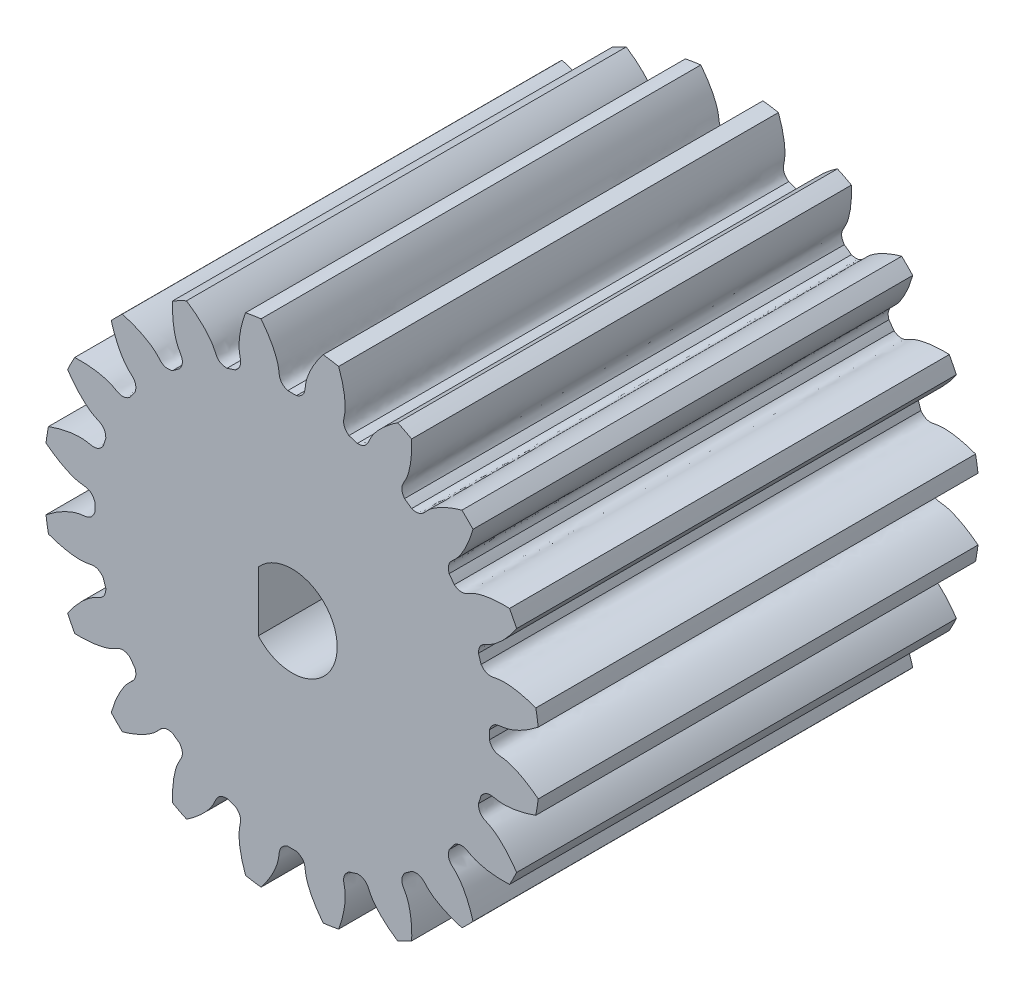
from build123d import *

# Parameters (mm, degrees)
SKETCH_1_R               = 11
EXTRUDE_1_DEPTH          = 19.5
CUT_EXTRUDE_1_DEPTH      = 25.944939367
PATTERN_CIRCULAR_1_COUNT = 20
CUT_EXTRUDE_2_DEPTH      = 10


with BuildPart() as part:
    # 草图1 → 凸台-拉伸1 (new body)
    with BuildSketch(Plane.XY):
        Circle(SKETCH_1_R)
    extrude(amount=EXTRUDE_1_DEPTH)

    # 草图2 → 切除-拉伸1 (cut, through all)
    with BuildSketch(Plane.XY):
        with BuildLine():
            ThreePointArc((0.1933166, 8.747864236), (0, 8.75), (-0.1933166, 8.747864236))
            add(Edge.make_bspline(
                [(-0.1933166, 8.747864236), (-0.611189405, 8.893475512), (-0.557084099, 9.187113699), (-0.612897056, 9.470009403), (-0.618892186, 9.497556614), (-0.62631089, 9.528634615), (-0.635292097, 9.563196836), (-0.64597914, 9.601191497), (-0.658512055, 9.642562828), (-0.673029871, 9.687250733), (-0.68966975, 9.735190947), (-0.7085671, 9.786315045), (-0.729855399, 9.840550501), (-0.753666102, 9.897820731), (-0.780128531, 9.958045151), (-0.809369765, 10.021139231), (-0.841514533, 10.087014551), (-0.876685117, 10.155578861), (-0.915001238, 10.22673615), (-0.956579966, 10.300386704), (-1.001535609, 10.376427181), (-1.049979626, 10.454750678), (-1.102020521, 10.535246805), (-1.157763756, 10.617801764), (-1.217311651, 10.70229842), (-1.280763301, 10.78861639), (-1.34821448, 10.876632121), (-1.419757562, 10.966218973), (-1.495481426, 11.057247311), (-1.575471385, 11.149584594), (-1.659809097, 11.243095463), (-1.748572489, 11.337641835), (-1.841835684, 11.433083002), (-1.939668926, 11.529275727), (-2.042138506, 11.626074339), (-2.149306698, 11.723330842), (-2.261231689, 11.820895011), (-2.377967518, 11.918614499), (-2.499564012, 12.016334946), (-2.626066734, 12.113900082), (-2.757516899, 12.21115184), (-2.941473591, 12.341639868), (-3.083932413, 12.436332601), (-3.181157982, 12.49825186)],
                knots=[0, 0, 0, 0, 0.165916003, 0.170905922, 0.176663519, 0.183188797, 0.190481754, 0.198542391, 0.207370708, 0.216966704, 0.22733038, 0.238461736, 0.250360771, 0.263027487, 0.276461881, 0.290663956, 0.30563371, 0.321371144, 0.337876258, 0.355149051, 0.373189524, 0.391997677, 0.411573509, 0.431917021, 0.453028213, 0.474907084, 0.497553636, 0.520967867, 0.545149777, 0.570099367, 0.595816637, 0.622301587, 0.649554216, 0.677574526, 0.706362514, 0.735918183, 0.766241531, 0.797332559, 0.829191267, 0.861817654, 0.895211721, 0.929373468, 1, 1, 1, 1], degree=3))
            ThreePointArc((-3.181157982, 12.49825186), (0, 12.89674632), (3.181157982, 12.49825186))
            add(Edge.make_bspline(
                [(0.1933166, 8.747864236), (0.611189405, 8.893475512), (0.557084099, 9.187113699), (0.612897056, 9.470009403), (0.618892186, 9.497556614), (0.62631089, 9.528634615), (0.635292097, 9.563196836), (0.64597914, 9.601191497), (0.658512055, 9.642562828), (0.673029871, 9.687250733), (0.68966975, 9.735190947), (0.7085671, 9.786315045), (0.729855399, 9.840550501), (0.753666102, 9.897820731), (0.780128531, 9.958045151), (0.809369765, 10.021139231), (0.841514533, 10.087014551), (0.876685117, 10.155578861), (0.915001238, 10.22673615), (0.956579966, 10.300386704), (1.001535609, 10.376427181), (1.049979626, 10.454750678), (1.102020521, 10.535246805), (1.157763756, 10.617801764), (1.217311651, 10.70229842), (1.280763301, 10.78861639), (1.34821448, 10.876632121), (1.419757562, 10.966218973), (1.495481426, 11.057247311), (1.575471385, 11.149584594), (1.659809097, 11.243095463), (1.748572489, 11.337641835), (1.841835684, 11.433083002), (1.939668926, 11.529275727), (2.042138506, 11.626074339), (2.149306698, 11.723330842), (2.261231689, 11.820895011), (2.377967518, 11.918614499), (2.499564012, 12.016334946), (2.626066734, 12.113900082), (2.757516899, 12.21115184), (2.941473591, 12.341639868), (3.083932413, 12.436332601), (3.181157982, 12.49825186)],
                knots=[0, 0, 0, 0, 0.165916003, 0.170905922, 0.176663519, 0.183188797, 0.190481754, 0.198542391, 0.207370708, 0.216966704, 0.22733038, 0.238461736, 0.250360771, 0.263027487, 0.276461881, 0.290663956, 0.30563371, 0.321371144, 0.337876258, 0.355149051, 0.373189524, 0.391997677, 0.411573509, 0.431917021, 0.453028213, 0.474907084, 0.497553636, 0.520967867, 0.545149777, 0.570099367, 0.595816637, 0.622301587, 0.649554216, 0.677574526, 0.706362514, 0.735918183, 0.766241531, 0.797332559, 0.829191267, 0.861817654, 0.895211721, 0.929373468, 1, 1, 1, 1], degree=3))
        make_face()
    cut_extrude_1 = extrude(amount=CUT_EXTRUDE_1_DEPTH, mode=Mode.SUBTRACT)

    # 阵列(圆周)1: 切除-拉伸1 ×20 about axis
    pattern_circular_1_axis = Axis((0, 0, -1.5), (0, 0, 1))
    for i in range(1, PATTERN_CIRCULAR_1_COUNT):
        add(cut_extrude_1.rotate(pattern_circular_1_axis, i * 360 / PATTERN_CIRCULAR_1_COUNT), mode=Mode.SUBTRACT)

    # 草图4 → 切除-拉伸2 (cut)
    with BuildSketch(Plane.XY.offset(19.5)):
        with BuildLine():
            Line((-1.5, 1.322875656), (-1.5, -1.322875656))
            ThreePointArc((-1.5, -1.322875656), (2, 0), (-1.5, 1.322875656))
        make_face()
    extrude(amount=-CUT_EXTRUDE_2_DEPTH, mode=Mode.SUBTRACT)


solid = part.part
